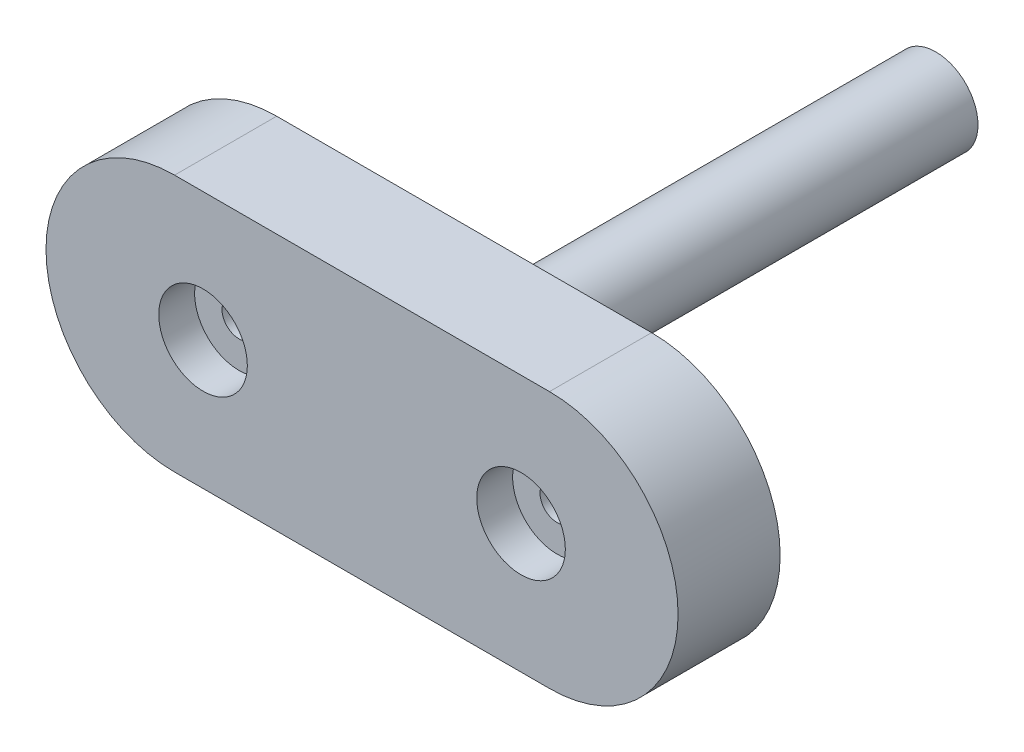
from build123d import *

# Parameters (mm, degrees)
SALIENTE_EXTRUIR1_DEPTH = 9.63
CROQUIS2_R              = 3.98
SALIENTE_EXTRUIR2_DEPTH = 44.5
CROQUIS3_R              = 1.6
CORTAR_EXTRUIR1_DEPTH   = 63.977202423
CROQUIS4_R              = 4.18
CORTAR_EXTRUIR2_DEPTH   = 3.39


with BuildPart() as part:
    # Croquis1 → Saliente-Extruir1 (new body)
    with BuildSketch(Plane.XY):
        with BuildLine():
            Line((-17.685, 12.13), (17.685, 12.13))
            ThreePointArc((17.685, 12.13), (29.815, 0), (17.685, -12.13))
            Line((17.685, -12.13), (-17.685, -12.13))
            ThreePointArc((-17.685, -12.13), (-29.815, 0), (-17.685, 12.13))
        make_face()
    extrude(amount=-SALIENTE_EXTRUIR1_DEPTH)

    # Croquis2 → Saliente-Extruir2 (add)
    with BuildSketch(Plane(origin=(0, 0, -9.63), x_dir=(-1, 0, 0), z_dir=(0, 0, -1))):
        with Locations(Location((0, 0, 0), (0, 0, 180))):
            Circle(CROQUIS2_R)
    extrude(amount=SALIENTE_EXTRUIR2_DEPTH)

    # Croquis3 → Cortar-Extruir1 (cut, through all)
    with BuildSketch(Plane.XY):
        with Locations((-15, 0)):
            Circle(CROQUIS3_R)
        with Locations((15, 0)):
            Circle(CROQUIS3_R)
    extrude(amount=-CORTAR_EXTRUIR1_DEPTH, mode=Mode.SUBTRACT)

    # Croquis4 → Cortar-Extruir2 (cut)
    with BuildSketch(Plane.XY):
        with Locations((-15, 0)):
            Circle(CROQUIS4_R)
        with Locations((15, 0)):
            Circle(CROQUIS4_R)
    extrude(amount=-CORTAR_EXTRUIR2_DEPTH, mode=Mode.SUBTRACT)


solid = part.part
